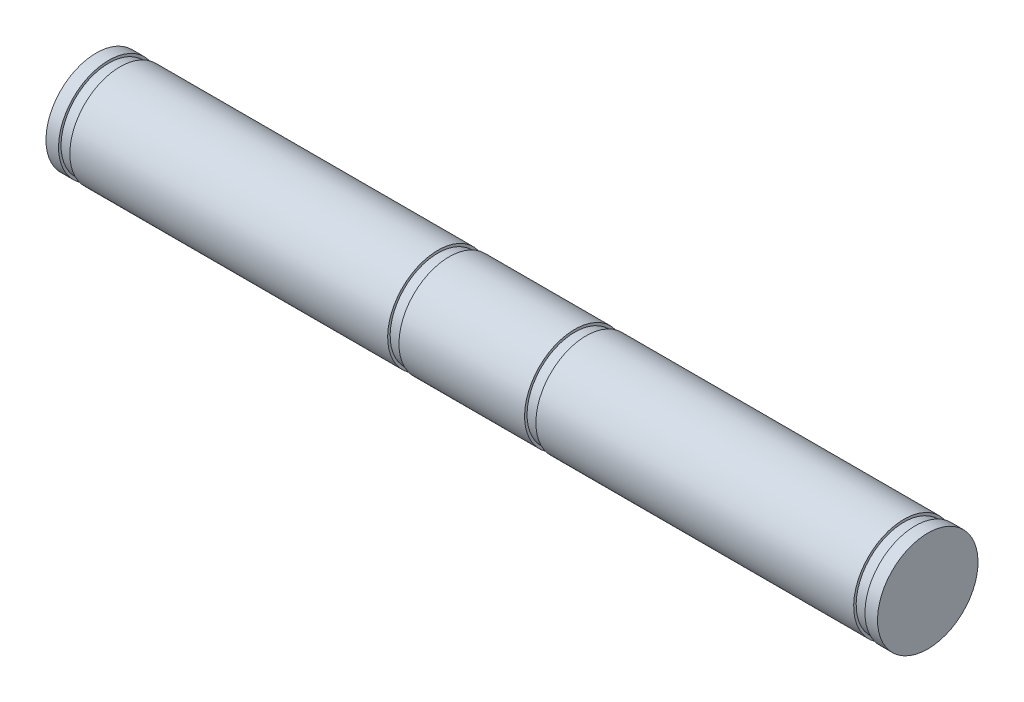
from build123d import *


with BuildPart() as part:
    # Sketch1 → Revolve1 (revolve)
    with BuildSketch(Plane.XY, mode=Mode.PRIVATE) as revolve1_sk:
        Polygon((0, 0), (64.3, 0), (64.3, 4), (63.3, 4), (63.3, 3.8), (62.4, 3.8), (62.4, 4), (37.1, 4), (37.1, 3.8), (36.2, 3.8), (36.2, 4), (26.2, 4), (26.2, 3.8), (25.3, 3.8), (25.3, 4), (0, 4), (0, 3.8), (-0.9, 3.8), (-0.9, 4), (-1.9, 4), (-1.9, 0), align=None)
    revolve(revolve1_sk.sketch.rotate(Axis((0, 0, 0), (1, 0, 0)), 180), axis=Axis((0, 0, 0), (1, 0, 0)))


solid = part.part
